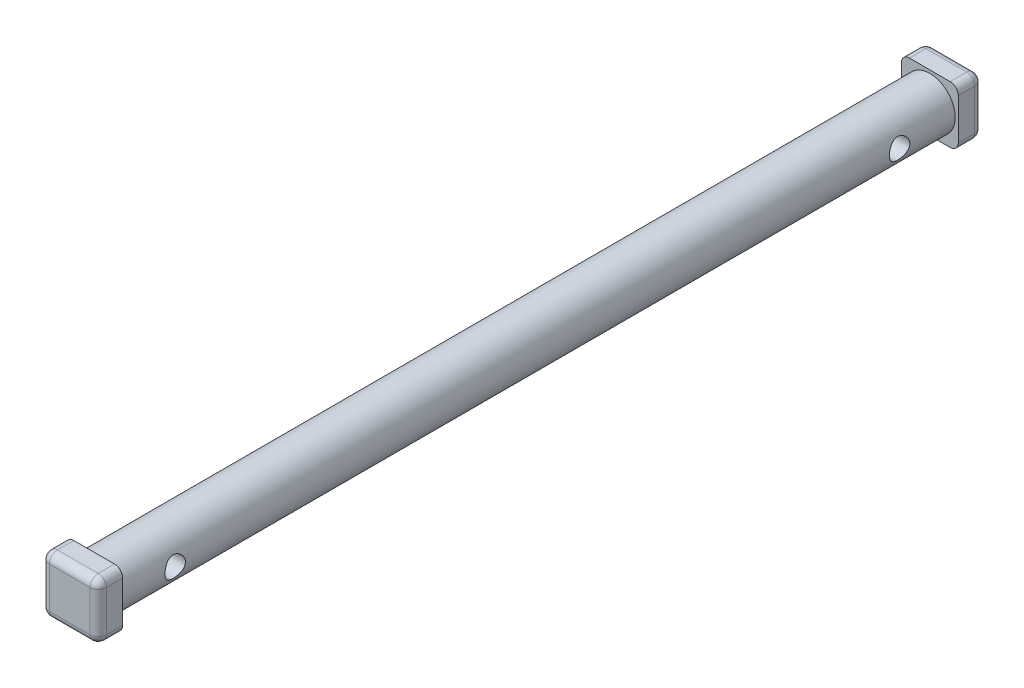
from build123d import *

# Parameters (mm, degrees)
SKETCH2_R           = 3.9624
BOSS_EXTRUDE1_DEPTH = 130.175
SKETCH3_W           = 16.328349939
SKETCH3_H           = 1.5875
SKETCH6_W           = 7.9248
SKETCH6_H           = 1.5875
SKETCH7_W           = 8.89
SKETCH7_H           = 8.89
BOSS_EXTRUDE2_DEPTH = 3.81
SKETCH8_W           = 8.89
SKETCH8_H           = 8.89
BOSS_EXTRUDE3_DEPTH = 3.81
FILLET1_R           = 1.27
FILLET2_R           = 1.27
FILLET3_R           = 1.27


with BuildPart() as part:
    # Sketch2 → Boss-Extrude1 (new body)
    with BuildSketch(Plane.XY):
        Circle(SKETCH2_R)
    extrude(amount=BOSS_EXTRUDE1_DEPTH)

    # Sketch3 → Cut-Revolve2 (revolve, cut)
    with BuildSketch(Plane(origin=(0, 0, 0), x_dir=(1, 0, 0), z_dir=(0, 1, 0)), mode=Mode.PRIVATE) as cut_revolve2_sk:
        with Locations((-0.379751444, -7.86765)):
            Rectangle(SKETCH3_W, SKETCH3_H)
    revolve(cut_revolve2_sk.sketch.rotate(Axis((7.784423526, 0, 8.6614), (-1, 0, 0)), 179.999999998), axis=Axis((7.784423526, 0, 8.6614), (-1, 0, 0)), mode=Mode.SUBTRACT)

    # Sketch6 → Cut-Revolve4 (revolve, cut)
    with BuildSketch(Plane(origin=(0, 0, 0), x_dir=(1, 0, 0), z_dir=(0, 1, 0))):
        with Locations((0, -122.30735)):
            Rectangle(SKETCH6_W, SKETCH6_H)
    revolve(axis=Axis((-3.9624, 0, 121.5136), (1, 0, 0)), mode=Mode.SUBTRACT)

    # Sketch7 → Boss-Extrude2 (add)
    with BuildSketch(Plane.XY.offset(130.175)):
        Rectangle(SKETCH7_W, SKETCH7_H)
    extrude(amount=BOSS_EXTRUDE2_DEPTH)

    # Sketch8 → Boss-Extrude3 (add)
    with BuildSketch(Plane(origin=(0, 0, 0), x_dir=(-1, 0, 0), z_dir=(0, 0, -1))):
        Rectangle(SKETCH8_W, SKETCH8_H)
    extrude(amount=BOSS_EXTRUDE3_DEPTH)

    # Fillet1
    fillet1_edges = [part.edges().sort_by_distance(p)[0] for p in [
        (0, 4.445, -3.81),
    ]]
    fillet(fillet1_edges, radius=FILLET1_R)

    # Fillet2
    fillet2_edges = [part.edges().sort_by_distance(p)[0] for p in [
        (-4.445, -4.445, -1.905),
        (4.445, -4.445, -1.905),
        (-4.445, -0.635, -3.81),
        (0, -4.445, -3.81),
        (4.445, -0.635, -3.81),
        (4.445, 4.445, -1.27),
        (4.445, 4.073025612, -3.438025612),
        (-4.445, 4.445, -1.27),
        (-4.445, 4.073025612, -3.438025612),
    ]]
    fillet(fillet2_edges, radius=FILLET2_R)

    # Fillet3
    fillet3_edges = [part.edges().sort_by_distance(p)[0] for p in [
        (4.445, -4.445, 132.08),
        (4.445, 4.445, 132.08),
        (-4.445, 4.445, 132.08),
        (-4.445, -4.445, 132.08),
        (4.445, 0, 133.985),
        (0, 4.445, 133.985),
        (-4.445, 0, 133.985),
        (0, -4.445, 133.985),
    ]]
    fillet(fillet3_edges, radius=FILLET3_R)


solid = part.part
